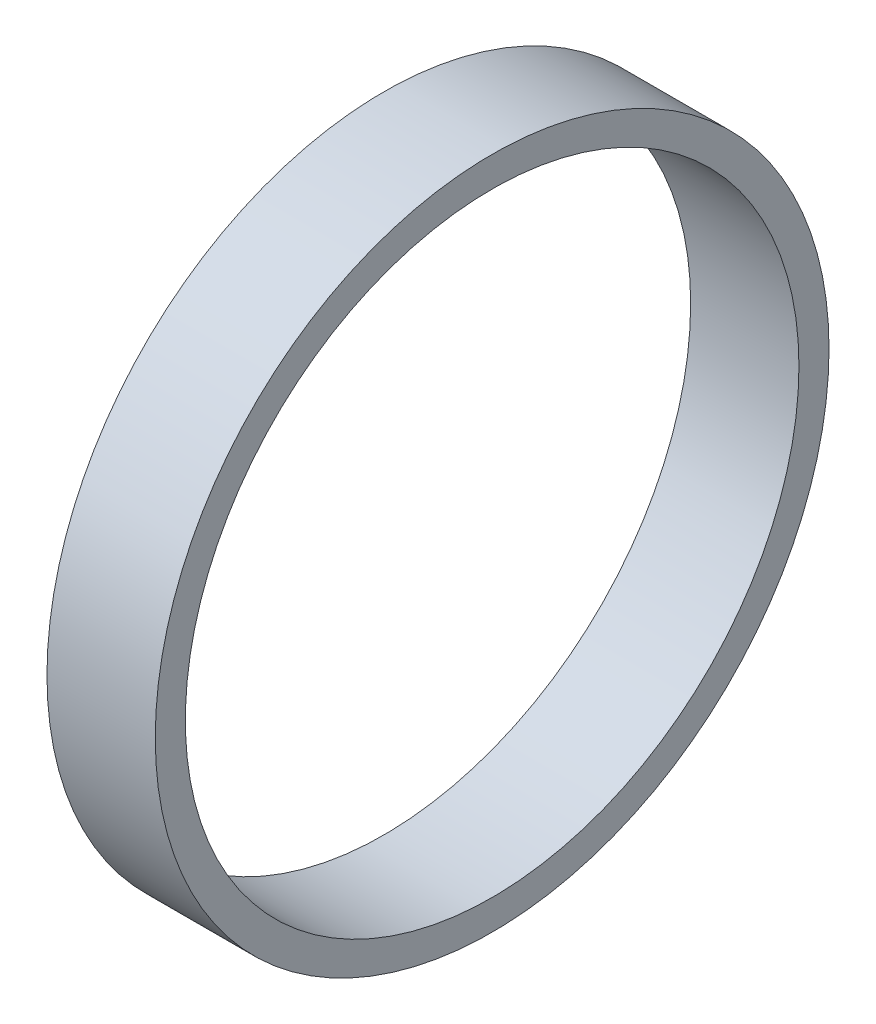
from build123d import *

# Parameters (mm, degrees)
SKIZZE1_R                       = 5.6
SKIZZE1_R_2                     = 5.1
AUFSATZ_LINEAR_AUSTRAGEN1_DEPTH = 1.8


with BuildPart() as part:
    # Skizze1 → Aufsatz-Linear austragen1 (new body)
    with BuildSketch(Plane(origin=(0, 0, 0), x_dir=(0, 0, -1), z_dir=(1, 0, 0))):
        Circle(SKIZZE1_R)
        Circle(SKIZZE1_R_2, mode=Mode.SUBTRACT)
    extrude(amount=AUFSATZ_LINEAR_AUSTRAGEN1_DEPTH)


solid = part.part
